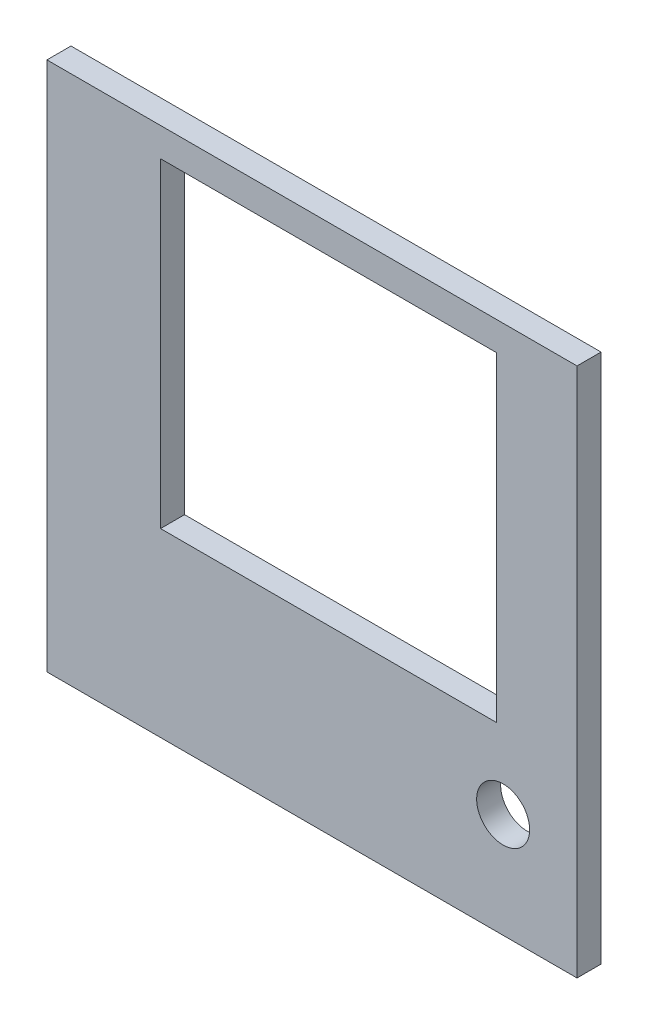
from build123d import *

# Parameters (mm, degrees)
SKETCH1_W           = 70
SKETCH1_H           = 70
SKETCH1_R           = 3.5
SKETCH1_W_2         = 44.35
SKETCH1_H_2         = 42.3
BOSS_EXTRUDE1_DEPTH = 3.175


with BuildPart() as part:
    # Sketch1 → Boss-Extrude1 (new body)
    with BuildSketch(Plane.XY):
        with Locations((35, 35)):
            Rectangle(SKETCH1_W, SKETCH1_H)
        with Locations((60.245, 13.825)):
            Circle(SKETCH1_R, mode=Mode.SUBTRACT)
        with Locations((37.175, 45.05)):
            Rectangle(SKETCH1_W_2, SKETCH1_H_2, mode=Mode.SUBTRACT)
    extrude(amount=BOSS_EXTRUDE1_DEPTH)


solid = part.part
